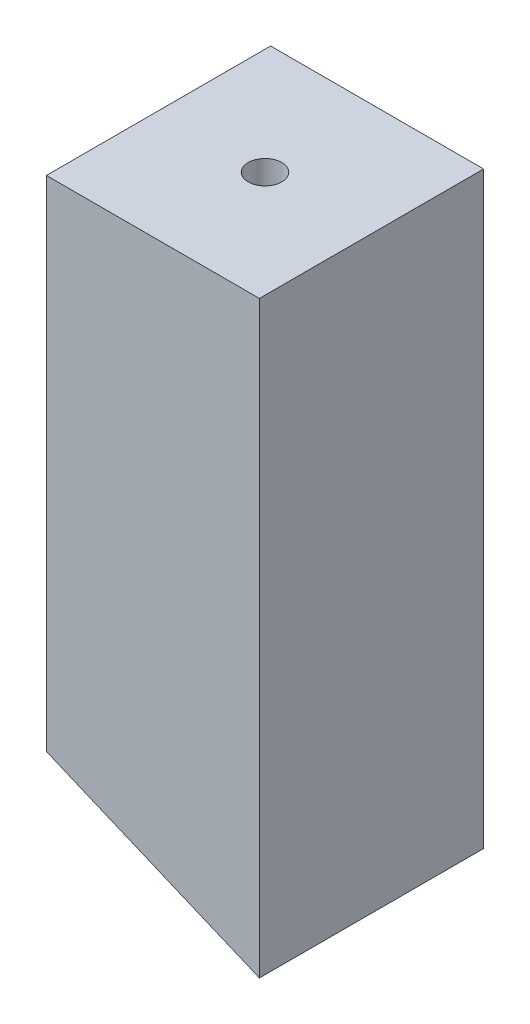
from build123d import *

# Parameters (mm, degrees)
EXTRUDE_1_DEPTH     = 20
SKETCH_2_R          = 1.5
CUT_EXTRUDE_1_DEPTH = 20


with BuildPart() as part:
    # 草图1 → 凸台-拉伸1 (new body)
    with BuildSketch(Plane.XY):
        Polygon((10.5, 12), (29.5, 4), (29.5, 56.5), (10.5, 56.5), align=None)
    extrude(amount=-EXTRUDE_1_DEPTH)

    # 草图2 → 切除-拉伸1 (cut)
    with BuildSketch(Plane(origin=(0, 56.5, 0), x_dir=(1, 0, 0), z_dir=(0, 1, 0))):
        with Locations(Location((20, 10, 0), (0, 0, 270))):
            Circle(SKETCH_2_R)
    extrude(amount=-CUT_EXTRUDE_1_DEPTH, mode=Mode.SUBTRACT)


solid = part.part
